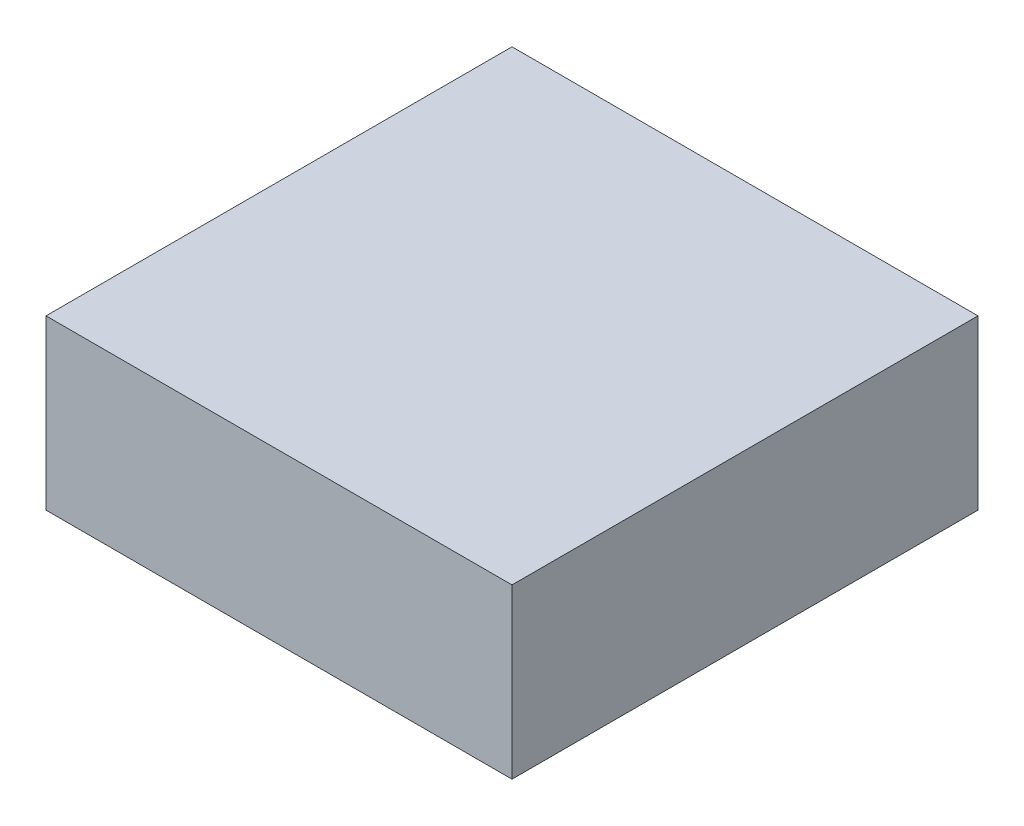
from build123d import *

# Parameters (mm, degrees)
CROQUIS2_W              = 18
CROQUIS2_H              = 18
CROQUIS2_W_2            = 13.5
CROQUIS2_H_2            = 13.5
SALIENTE_EXTRUIR1_DEPTH = 5
CROQUIS3_W              = 18
CROQUIS3_H              = 18
SALIENTE_EXTRUIR2_DEPTH = 1.5


with BuildPart() as part:
    # Croquis2 → Saliente-Extruir1 (new body)
    with BuildSketch(Plane(origin=(0, 0, 0), x_dir=(1, 0, 0), z_dir=(0, 1, 0))):
        Rectangle(CROQUIS2_W, CROQUIS2_H)
        Rectangle(CROQUIS2_W_2, CROQUIS2_H_2, mode=Mode.SUBTRACT)
    extrude(amount=SALIENTE_EXTRUIR1_DEPTH)

    # Croquis3 → Saliente-Extruir2 (add)
    with BuildSketch(Plane(origin=(0, 5, 0), x_dir=(1, 0, 0), z_dir=(0, 1, 0))):
        Rectangle(CROQUIS3_W, CROQUIS3_H)
    extrude(amount=SALIENTE_EXTRUIR2_DEPTH)


solid = part.part
